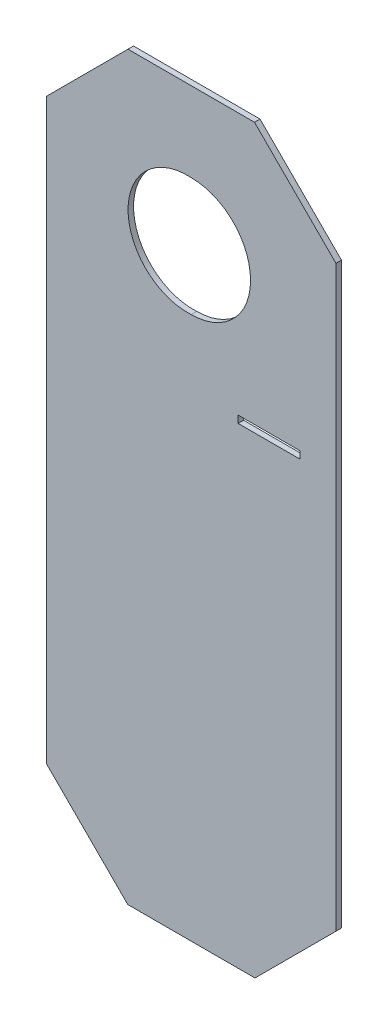
from build123d import *

# Parameters (mm, degrees)
EXTRUDE_1_DEPTH     = 4
CUT_EXTRUDE_1_DEPTH = 650.396885451
SKETCH_3_W          = 45
SKETCH_3_H          = 5.25
CUT_EXTRUDE_2_DEPTH = 650.396885451


with BuildPart() as part:
    # Эскиз1 → Вытянуть1 (new body)
    with BuildSketch(Plane.XY):
        Polygon((105.082921559, 581.722068254), (45.979042749, 640.825947064), (-45.813199631, 640.825947064), (-104.917078441, 581.722068254), (-104.917078441, 162.212880509), (-45.97317451, 103.268976578), (46.326817337, 103.268976578), (105.082921559, 162.0250808), align=None)
    extrude(amount=EXTRUDE_1_DEPTH)

    # Эскиз2 → Вырез-Вытянуть1 (cut, through all)
    with BuildSketch(Plane.XY.offset(4)):
        with BuildLine():
            ThreePointArc((0.117260776, 497.024602251), (43.117260776, 540.024602251), (0.117260776, 583.024602251))
            ThreePointArc((0.117260776, 583.024602251), (-45.765193681, 540.024602251), (0.117260776, 497.024602251))
        make_face()
    extrude(amount=-CUT_EXTRUDE_1_DEPTH, mode=Mode.SUBTRACT)

    # Эскиз3 → Вырез-Вытянуть2 (cut, through all)
    with BuildSketch(Plane(origin=(0, 0, 0), x_dir=(-1, 0, 0), z_dir=(0, 0, -1))):
        with Locations((-56.614229098, 448.250896744)):
            Rectangle(SKETCH_3_W, SKETCH_3_H)
    extrude(amount=-CUT_EXTRUDE_2_DEPTH, mode=Mode.SUBTRACT)


solid = part.part
